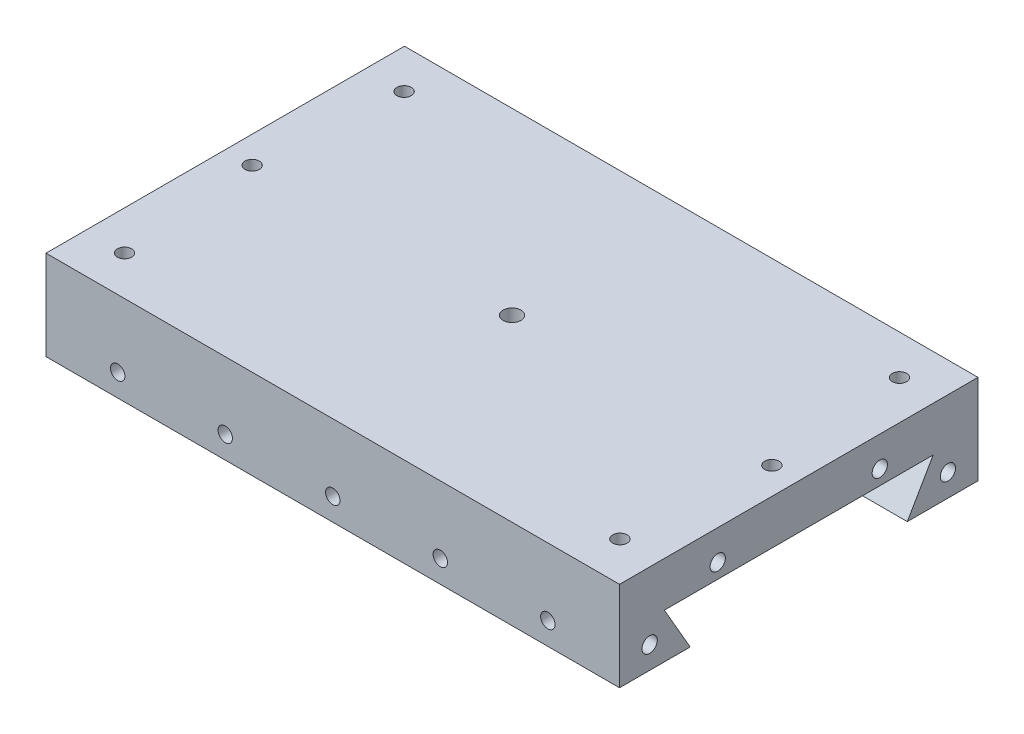
from build123d import *

# Parameters (mm, degrees)
FEMALE_DOVETAIL_EXTRUDE_DEPTH                = 203.2
END_PLATES_1_4_28_TAPPED_HOLE_D              = 5.1054
END_PLATES_1_4_28_TAPPED_HOLE_DEPTH          = 16.51
END_PLATES_1_4_28_TAPPED_HOLE_TIP            = 1.533816902
END_PLATES_1_4_28_TAPPED_HOLE1_D             = 5.4102
END_PLATES_1_4_28_TAPPED_HOLE1_DEPTH         = 15.494
END_PLATES_1_4_28_TAPPED_HOLE1_TIP           = 1.625388061
SWIVEL_BLOCK_MOUNT_1_4_20_TAPPED_HOLE5_D     = 5.1054
SWIVEL_BLOCK_MOUNT_1_4_20_TAPPED_HOLE5_DEPTH = 10.16
SWIVEL_BLOCK_MOUNT_1_4_20_TAPPED_HOLE5_TIP   = 1.533816902
SWIVEL_LOCATING_1_4_0_25_CLEARANCE_DOW_D     = 6.35
SWIVEL_LOCATING_1_4_0_25_CLEARANCE_DOW_DEPTH = 6.35
SKETCH22_W                                   = 2.5527
SKETCH22_H                                   = 63.5
GIB_SCREW_1_4_20_TAPPED_HOLE6_AT_2_COUNT     = 2
GIB_SCREW_1_4_20_TAPPED_HOLE6_AT_2_PITCH     = 38.1
GIB_SCREW_1_4_20_TAPPED_HOLE6_AT_3_COUNT     = 2
GIB_SCREW_1_4_20_TAPPED_HOLE6_AT_3_PITCH     = 76.2
GIB_SCREW_1_4_20_TAPPED_HOLE6_AT_4_COUNT     = 2
GIB_SCREW_1_4_20_TAPPED_HOLE6_AT_4_PITCH     = 114.3
GIB_SCREW_1_4_20_TAPPED_HOLE6_AT_5_COUNT     = 2
GIB_SCREW_1_4_20_TAPPED_HOLE6_AT_5_PITCH     = 152.4


with BuildPart() as part:
    # Sketch1 → female dovetail extrude (new body)
    with BuildSketch(Plane(origin=(0, 0, 0), x_dir=(0, 0, -1), z_dir=(1, 0, 0))):
        Polygon((63.5, 31.75), (-63.5, 31.75), (-63.5, 0), (-38.459564477, 0), (-47.625, 15.875), (-40.292651581, 15.875), (-16.056336319, 15.875), (16.056336319, 15.875), (47.625, 15.875), (38.459564477, 0), (63.5, 0), align=None)
    extrude(amount=FEMALE_DOVETAIL_EXTRUDE_DEPTH)

    # end plates 1/4-28 Tapped Hole
    with Locations(Plane(origin=(0, -44.45, -248.332419753), x_dir=(0, 0, 1), z_dir=(-1, 0, 0))):
        with Locations((195.500419753, 52.3875), (219.630419753, 65.532), (277.034419753, 65.532), (301.164419753, 52.3875)):
            Hole(END_PLATES_1_4_28_TAPPED_HOLE_D / 2, depth=END_PLATES_1_4_28_TAPPED_HOLE_DEPTH)
            with Locations((0, 0, -(END_PLATES_1_4_28_TAPPED_HOLE_DEPTH + END_PLATES_1_4_28_TAPPED_HOLE_TIP / 2))):  # 118° drill point
                Cone(0, END_PLATES_1_4_28_TAPPED_HOLE_D / 2, END_PLATES_1_4_28_TAPPED_HOLE_TIP, mode=Mode.SUBTRACT)

    # end plates 1/4-28 Tapped Hole1
    with Locations(Plane(origin=(203.2, -44.45, -248.332419753), x_dir=(0, 0, -1), z_dir=(1, 0, 0))):
        with Locations((-301.164419753, 52.3875), (-277.034419753, 65.532), (-219.630419753, 65.532), (-195.500419753, 52.3875)):
            Hole(END_PLATES_1_4_28_TAPPED_HOLE1_D / 2, depth=END_PLATES_1_4_28_TAPPED_HOLE1_DEPTH)
            with Locations((0, 0, -(END_PLATES_1_4_28_TAPPED_HOLE1_DEPTH + END_PLATES_1_4_28_TAPPED_HOLE1_TIP / 2))):  # 118° drill point
                Cone(0, END_PLATES_1_4_28_TAPPED_HOLE1_D / 2, END_PLATES_1_4_28_TAPPED_HOLE1_TIP, mode=Mode.SUBTRACT)

    # swivel block mount 1/4-20 Tapped Hole5
    with Locations(Plane(origin=(0, 31.75, 0), x_dir=(1, 0, 0), z_dir=(0, 1, 0))):
        with Locations((13.843, -49.53), (9.525, 0), (13.843, 49.53), (189.357, 49.53), (193.675, 0), (189.357, -49.53)):
            Hole(SWIVEL_BLOCK_MOUNT_1_4_20_TAPPED_HOLE5_D / 2, depth=SWIVEL_BLOCK_MOUNT_1_4_20_TAPPED_HOLE5_DEPTH)
            with Locations((0, 0, -(SWIVEL_BLOCK_MOUNT_1_4_20_TAPPED_HOLE5_DEPTH + SWIVEL_BLOCK_MOUNT_1_4_20_TAPPED_HOLE5_TIP / 2))):  # 118° drill point
                Cone(0, SWIVEL_BLOCK_MOUNT_1_4_20_TAPPED_HOLE5_D / 2, SWIVEL_BLOCK_MOUNT_1_4_20_TAPPED_HOLE5_TIP, mode=Mode.SUBTRACT)

    # swivel locating 1/4 (0.25) Clearance Dowel Hole1
    with Locations(Plane(origin=(39.932785273, 31.75, 145.909625699), x_dir=(1, 0, 0), z_dir=(0, 1, 0))):
        with Locations((61.667214727, 145.909625699)):
            Hole(SWIVEL_LOCATING_1_4_0_25_CLEARANCE_DOW_D / 2, depth=SWIVEL_LOCATING_1_4_0_25_CLEARANCE_DOW_DEPTH)

    # Sketch22 → gib screw 1/4-20 Tapped Hole6 (revolve, cut)
    with BuildSketch(Plane(origin=(25.4, 7.9375, 0), x_dir=(0, 1, 0), z_dir=(1, 0, 0))):
        with Locations((1.27635, 31.75)):
            Rectangle(SKETCH22_W, SKETCH22_H)
    gib_screw_1_4_20_tapped_hole6 = revolve(axis=Axis((25.4, 7.9375, -6.35), (0, 0, 1)), mode=Mode.SUBTRACT)

    # gib screw 1/4-20 Tapped Hole6 at 2: gib screw 1/4-20 Tapped Hole6 ×2
    with Locations(*[(i * GIB_SCREW_1_4_20_TAPPED_HOLE6_AT_2_PITCH, 0, 0) for i in range(1, GIB_SCREW_1_4_20_TAPPED_HOLE6_AT_2_COUNT)]):
        add(gib_screw_1_4_20_tapped_hole6, mode=Mode.SUBTRACT)

    # gib screw 1/4-20 Tapped Hole6 at 3: gib screw 1/4-20 Tapped Hole6 ×2
    with Locations(*[(i * GIB_SCREW_1_4_20_TAPPED_HOLE6_AT_3_PITCH, 0, 0) for i in range(1, GIB_SCREW_1_4_20_TAPPED_HOLE6_AT_3_COUNT)]):
        add(gib_screw_1_4_20_tapped_hole6, mode=Mode.SUBTRACT)

    # gib screw 1/4-20 Tapped Hole6 at 4: gib screw 1/4-20 Tapped Hole6 ×2
    with Locations(*[(i * GIB_SCREW_1_4_20_TAPPED_HOLE6_AT_4_PITCH, 0, 0) for i in range(1, GIB_SCREW_1_4_20_TAPPED_HOLE6_AT_4_COUNT)]):
        add(gib_screw_1_4_20_tapped_hole6, mode=Mode.SUBTRACT)

    # gib screw 1/4-20 Tapped Hole6 at 5: gib screw 1/4-20 Tapped Hole6 ×2
    with Locations(*[(i * GIB_SCREW_1_4_20_TAPPED_HOLE6_AT_5_PITCH, 0, 0) for i in range(1, GIB_SCREW_1_4_20_TAPPED_HOLE6_AT_5_COUNT)]):
        add(gib_screw_1_4_20_tapped_hole6, mode=Mode.SUBTRACT)


solid = part.part
